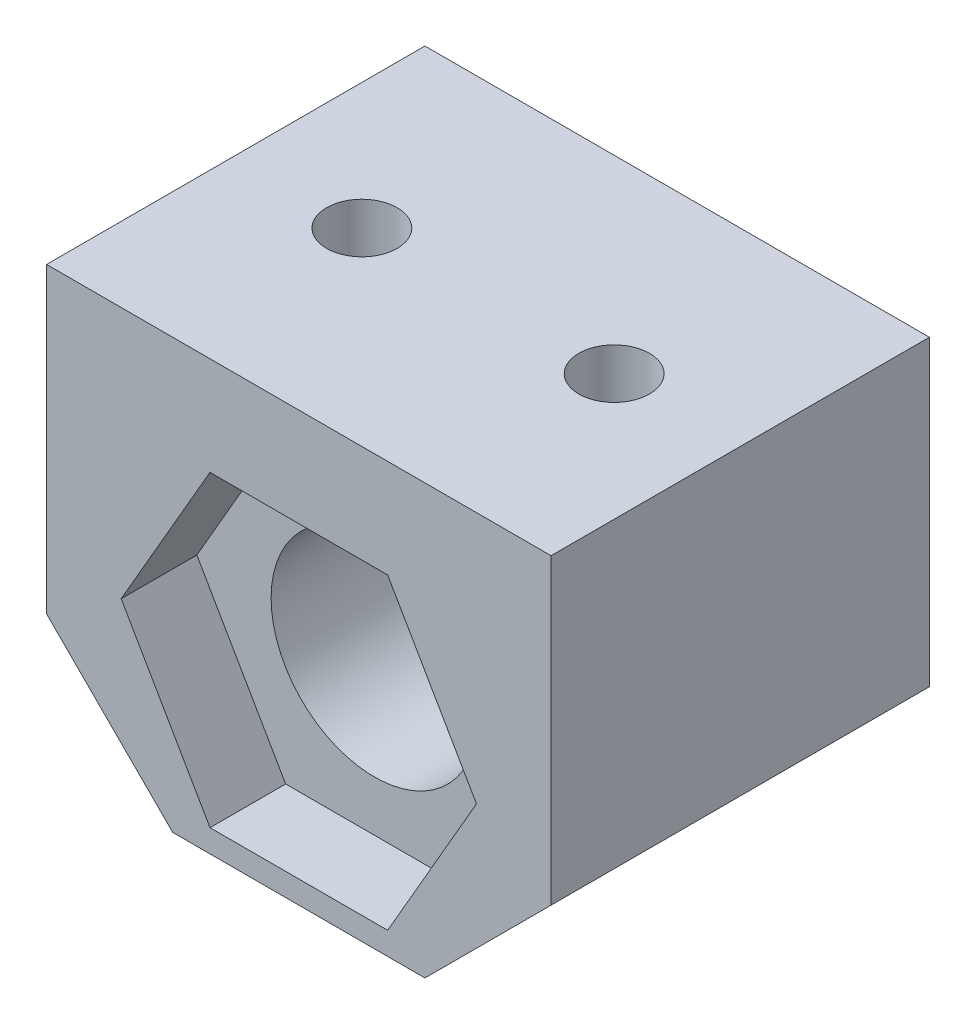
from build123d import *

# Parameters (mm, degrees)
SKETCH_1_R          = 4.1
EXTRUDE_1_DEPTH     = 7.5
CUT_EXTRUDE_1_DEPTH = 3
SKETCH_3_R          = 1.4
CUT_EXTRUDE_4_DEPTH = 10


with BuildPart() as part:
    # 草图1 → 凸台-拉伸1 (new, symmetric)
    with BuildSketch(Plane.XY):
        Polygon((-10, 10), (10, 10), (10, -2), (5, -7), (-5, -7), (-10, -2), align=None)
        Circle(SKETCH_1_R, mode=Mode.SUBTRACT)
    extrude(amount=EXTRUDE_1_DEPTH, both=True)

    # 草图2 → 切除-拉伸1 (cut)
    with BuildSketch(Plane.XY.offset(7.5)):
        Polygon((7.043673284, 0), (3.521836642, 6.1), (-3.521836642, 6.1), (-7.043673284, 0), (-3.521836642, -6.1), (3.521836642, -6.1), align=None)
    extrude(amount=-CUT_EXTRUDE_1_DEPTH, mode=Mode.SUBTRACT)

    # 草图3 → 切除-拉伸4 (cut)
    with BuildSketch(Plane(origin=(0, 10, 0), x_dir=(1, 0, 0), z_dir=(0, 1, 0))):
        with Locations(Location((5, 0, 0), (0, 0, 270))):
            Circle(SKETCH_3_R)
        with Locations(Location((-5, 0, 0), (0, 0, 270))):
            Circle(SKETCH_3_R)
    extrude(amount=-CUT_EXTRUDE_4_DEPTH, mode=Mode.SUBTRACT)


solid = part.part
